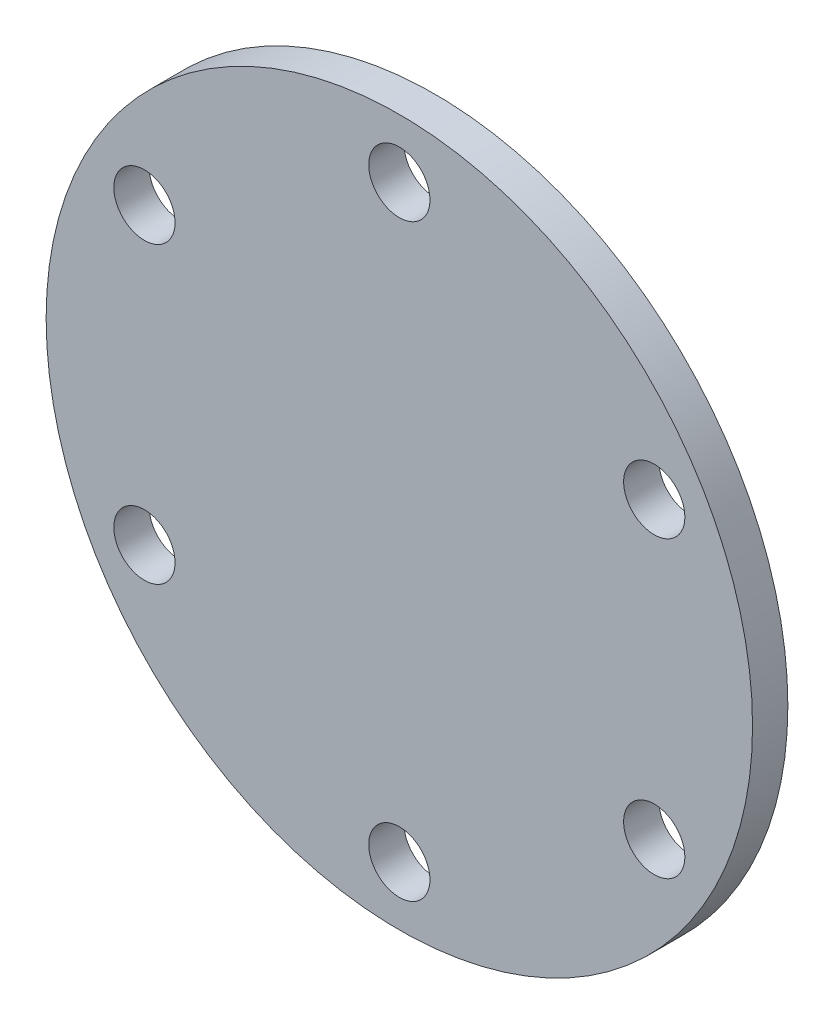
from build123d import *

# Parameters (mm, degrees)
SKETCH1_R           = 30
SKETCH1_R_2         = 2.6
BOSS_EXTRUDE1_DEPTH = 3


with BuildPart() as part:
    # Sketch1 → Boss-Extrude1 (new body)
    with BuildSketch(Plane.XY):
        Circle(SKETCH1_R)
        with Locations((0, 25)):
            Circle(SKETCH1_R_2, mode=Mode.SUBTRACT)
        with Locations((21.650635095, 12.5)):
            Circle(SKETCH1_R_2, mode=Mode.SUBTRACT)
        with Locations((21.650635095, -12.5)):
            Circle(SKETCH1_R_2, mode=Mode.SUBTRACT)
        with Locations((0, -25)):
            Circle(SKETCH1_R_2, mode=Mode.SUBTRACT)
        with Locations((-21.650635095, -12.5)):
            Circle(SKETCH1_R_2, mode=Mode.SUBTRACT)
        with Locations((-21.650635095, 12.5)):
            Circle(SKETCH1_R_2, mode=Mode.SUBTRACT)
    extrude(amount=BOSS_EXTRUDE1_DEPTH)


solid = part.part
